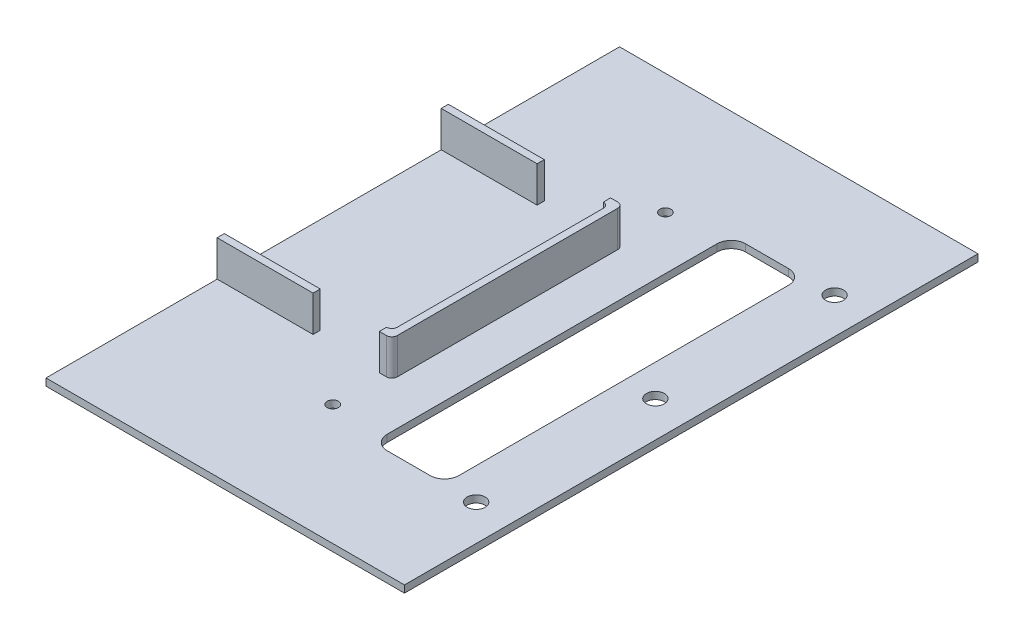
from build123d import *

# Parameters (mm, degrees)
SKETCH_1_R          = 2.5
EXTRUDE_4_DEPTH     = 2
SKETCH_4_R          = 1.5
CUT_EXTRUDE_2_DEPTH = 2
SKETCH_6_W          = 26.75
SKETCH_6_H          = 2
EXTRUDE_5_DEPTH     = 10
SKETCH_7_R          = 1.5
SKETCH_7_R_2        = 1.663234229
EXTRUDE_6_DEPTH     = 2
SKETCH_8_R          = 1.55
CUT_EXTRUDE_3_DEPTH = 2


with BuildPart() as part:
    # 草图1 → 凸台-拉伸4 (new body)
    with BuildSketch(Plane(origin=(0, 0, 0), x_dir=(1, 0, 0), z_dir=(0, 1, 0))):
        Polygon((0, 0), (0, -80), (70, -80), (100, -80), (100, 80), (70, 80), (0, 80), align=None)
        with Locations(Location((90, -50, 0), (0, 0, 270))):
            Circle(SKETCH_1_R, mode=Mode.SUBTRACT)
        with Locations(Location((90, 0, 0), (0, 0, 270))):
            Circle(SKETCH_1_R, mode=Mode.SUBTRACT)
        with Locations(Location((90, 50, 0), (0, 0, 270))):
            Circle(SKETCH_1_R, mode=Mode.SUBTRACT)
    extrude(amount=EXTRUDE_4_DEPTH)

    # 草图4 → 切除-拉伸2 (cut)
    with BuildSketch(Plane(origin=(0, 2, 0), x_dir=(1, 0, 0), z_dir=(0, 1, 0))):
        with BuildLine():
            Line((65.178018522, 50), (77.178018522, 50))
            ThreePointArc((77.178018522, 50), (80.006445646, 48.828427125), (81.178018522, 46))
            Line((81.178018522, 46), (81.178018522, -46))
            ThreePointArc((81.178018522, -46), (80.006445646, -48.828427125), (77.178018522, -50))
            Line((77.178018522, -50), (65.178018522, -50))
            ThreePointArc((65.178018522, -50), (62.349591397, -48.828427125), (61.178018522, -46))
            Line((61.178018522, -46), (61.178018522, 46))
            ThreePointArc((61.178018522, 46), (62.349591397, 48.828427125), (65.178018522, 50))
        make_face()
        with Locations(Location((47.4, -47.4, 0), (0, 0, 270))):
            Circle(SKETCH_4_R)
        with Locations(Location((47.4, 47.4, 0), (0, 0, 270))):
            Circle(SKETCH_4_R)
    extrude(amount=-CUT_EXTRUDE_2_DEPTH, mode=Mode.SUBTRACT)

    # 草图6 → 凸台-拉伸5 (add)
    with BuildSketch(Plane(origin=(0, 2, 0), x_dir=(1, 0, 0), z_dir=(0, 1, 0))):
        with Locations((13.375, -31.25)):
            Rectangle(SKETCH_6_W, SKETCH_6_H)
        with BuildLine():
            Line((47.25, 32.25), (46.75, 32.25))
            Line((46.75, 32.25), (46.75, 28.75))
            Line((46.75, 28.75), (46.75, -28.75))
            Line((46.75, -28.75), (46.75, -32.25))
            Line((46.75, -32.25), (47.25, -32.25))
            ThreePointArc((47.25, -32.25), (48.310660172, -31.810660172), (48.75, -30.75))
            Line((48.75, -30.75), (48.75, 30.75))
            ThreePointArc((48.75, 30.75), (48.310660172, 31.810660172), (47.25, 32.25))
        make_face()
        with BuildLine():
            Line((46.75, -32.25), (46.75, -28.75))
            ThreePointArc((46.75, -28.75), (46.310660172, -29.810660172), (45.25, -30.25))
            Line((45.25, -30.25), (45.25, -32.25))
            Line((45.25, -32.25), (46.75, -32.25))
        make_face()
        with BuildLine():
            Line((46.75, 32.25), (45.25, 32.25))
            Line((45.25, 32.25), (45.25, 30.25))
            ThreePointArc((45.25, 30.25), (46.310660172, 29.810660172), (46.75, 28.75))
            Line((46.75, 28.75), (46.75, 32.25))
        make_face()
        with Locations((13.375, 31.25)):
            Rectangle(SKETCH_6_W, SKETCH_6_H)
    extrude(amount=EXTRUDE_5_DEPTH)

    # 草图7 → 凸台-拉伸6 (add)
    with BuildSketch(Plane(origin=(0, 2, 0), x_dir=(1, 0, 0), z_dir=(0, 1, 0))):
        with Locations((47.4, 47.4)):
            Circle(SKETCH_7_R)
        with Locations((47.4, -47.4)):
            Circle(SKETCH_7_R_2)
    extrude(amount=-EXTRUDE_6_DEPTH)

    # 草图8 → 切除-拉伸3 (cut)
    with BuildSketch(Plane(origin=(0, 2, 0), x_dir=(1, 0, 0), z_dir=(0, 1, 0))):
        with BuildLine():
            ThreePointArc((47.95, 46.4), (47.496015511, 47.496015511), (46.4, 47.95))
            Line((46.4, 47.95), (46.4, 46.4))
            Line((46.4, 46.4), (47.95, 46.4))
        make_face()
        with BuildLine():
            Line((46.4, 46.4), (46.4, 47.95))
            ThreePointArc((46.4, 47.95), (45.303984489, 45.303984489), (47.95, 46.4))
            Line((47.95, 46.4), (46.4, 46.4))
        make_face()
        with Locations(Location((46.4, -46.4, 0), (0, 0, 270))):
            Circle(SKETCH_8_R)
    extrude(amount=-CUT_EXTRUDE_3_DEPTH, mode=Mode.SUBTRACT)


solid = part.part
